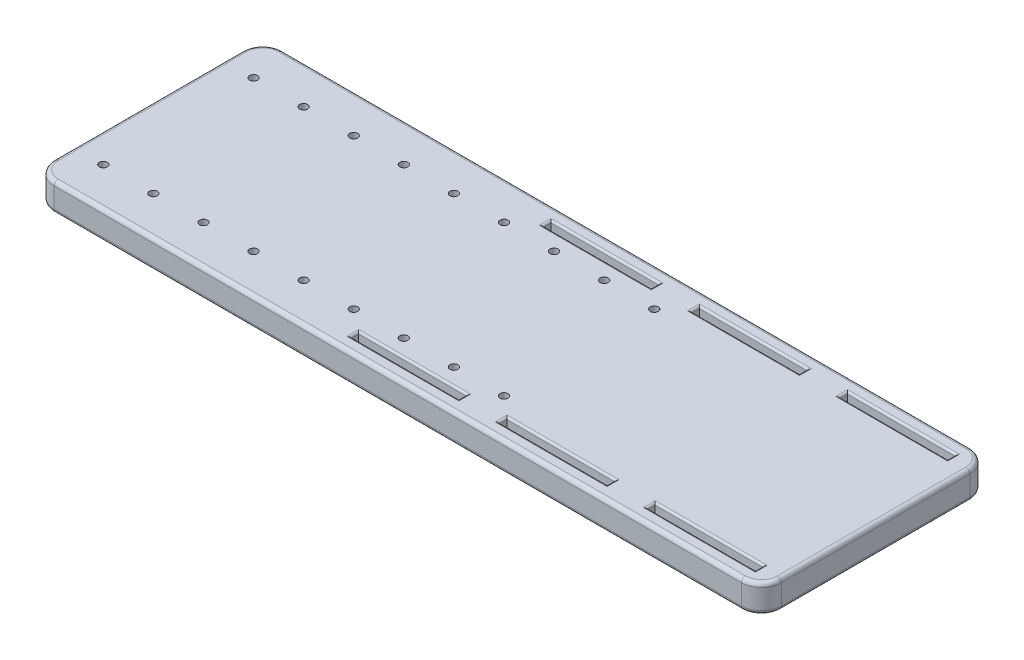
from build123d import *

# Parameters (mm, degrees)
SKETCH6_W              = 181.5
SKETCH6_H              = 7
BOSS_EXTRUDE2_DEPTH    = 28.5
SKETCH2_W              = 27
SKETCH2_H              = 2
CUT_EXTRUDE1_DEPTH     = 7
SKETCH3_R              = 1
CUT_EXTRUDE2_DEPTH     = 96.377211639
SKETCH4_R              = 2
CUT_EXTRUDE3_DEPTH     = 1.75
FILLET5_R              = 0.5
LPATTERN1_COUNT        = 9
LPATTERN1_PITCH        = 12.5
FILLET5_OF_LPATTERN1_R = 0.5
FILLET2_R              = 0.5
FILLET6_R              = 5
FILLET7_R              = 1
PART_NUMBER_CUT_DEPTH  = 0.6


with BuildPart() as part:
    # Sketch6 → Boss-Extrude2 (new, symmetric)
    with BuildSketch(Plane.XY):
        Rectangle(SKETCH6_W, SKETCH6_H)
    extrude(amount=BOSS_EXTRUDE2_DEPTH, both=True)

    # Sketch2 → Cut-Extrude1 (cut)
    with BuildSketch(Plane(origin=(0, 3.5, 24.5), x_dir=(1, 0, 0), z_dir=(0, -1, 0))):
        with Locations((-1.75, -0.5)):
            Rectangle(SKETCH2_W, SKETCH2_H)
        with Locations((35.25, -0.5)):
            Rectangle(SKETCH2_W, SKETCH2_H)
        with Locations((72.25, -0.5)):
            Rectangle(SKETCH2_W, SKETCH2_H)
        with Locations((-1.75, -48.5)):
            Rectangle(SKETCH2_W, SKETCH2_H)
        with Locations((35.25, -48.5)):
            Rectangle(SKETCH2_W, SKETCH2_H)
        with Locations((72.25, -48.5)):
            Rectangle(SKETCH2_W, SKETCH2_H)
    extrude(amount=CUT_EXTRUDE1_DEPTH, mode=Mode.SUBTRACT)

    # Sketch3 → Cut-Extrude2 (cut, through all)
    with BuildSketch(Plane(origin=(0, 3.5, 0), x_dir=(1, 0, 0), z_dir=(0, 1, 0))):
        with Locations(Location((16.75, 18.75, 0), (0, 0, 270))):
            Circle(SKETCH3_R)
        with Locations(Location((16.75, -18.75, 0), (0, 0, 270))):
            Circle(SKETCH3_R)
    cut_extrude2 = extrude(amount=-CUT_EXTRUDE2_DEPTH, mode=Mode.SUBTRACT)

    # Sketch4 → Cut-Extrude3 (cut)
    with BuildSketch(Plane.XZ.offset(3.5)):
        with Locations(Location((16.75, -18.75, 0), (0, 0, 270))):
            Circle(SKETCH4_R)
        with Locations(Location((16.75, 18.75, 0), (0, 0, 270))):
            Circle(SKETCH4_R)
    cut_extrude3 = extrude(amount=-CUT_EXTRUDE3_DEPTH, mode=Mode.SUBTRACT)

    # Fillet5
    fillet5_edges = [part.edges().sort_by_distance(p)[0] for p in [
        (16.75, -3.5, -16.75),
        (16.75, -3.5, 20.75),
    ]]
    fillet(fillet5_edges, radius=FILLET5_R)

    # LPattern1: Cut-Extrude2, Cut-Extrude3 ×9
    with Locations(*[(-i * LPATTERN1_PITCH, 0, 0) for i in range(1, LPATTERN1_COUNT)]):
        add(cut_extrude2, mode=Mode.SUBTRACT)
        add(cut_extrude3, mode=Mode.SUBTRACT)

    # Fillet5 of LPattern1
    fillet5_of_lpattern1_edges = [part.edges().sort_by_distance(p)[0] for p in [
        (4.25, -3.5, -16.75),
        (4.25, -3.5, 20.75),
        (-8.25, -3.5, -16.75),
        (-8.25, -3.5, 20.75),
        (-20.75, -3.5, -16.75),
        (-20.75, -3.5, 20.75),
        (-33.25, -3.5, -16.75),
        (-33.25, -3.5, 20.75),
        (-45.75, -3.5, -16.75),
        (-45.75, -3.5, 20.75),
        (-58.25, -3.5, -16.75),
        (-58.25, -3.5, 20.75),
        (-70.75, -3.5, -16.75),
        (-70.75, -3.5, 20.75),
        (-83.25, -3.5, -16.75),
        (-83.25, -3.5, 20.75),
    ]]
    fillet(fillet5_of_lpattern1_edges, radius=FILLET5_OF_LPATTERN1_R)

    # Fillet2
    fillet2_edges = [part.edges().sort_by_distance(p)[0] for p in [
        (35.25, -3.5, 23),
        (35.25, 3.5, 23),
        (21.75, -3.5, 24),
        (21.75, 3.5, 24),
        (35.25, -3.5, 25),
        (35.25, 3.5, 25),
        (48.75, -3.5, 24),
        (48.75, 3.5, 24),
        (72.25, -3.5, 23),
        (72.25, 3.5, 23),
        (58.75, -3.5, 24),
        (58.75, 3.5, 24),
        (72.25, -3.5, 25),
        (72.25, 3.5, 25),
        (85.75, -3.5, 24),
        (85.75, 3.5, 24),
        (-1.75, -3.5, -25),
        (-1.75, 3.5, -25),
        (-15.25, -3.5, -24),
        (-15.25, 3.5, -24),
        (-1.75, -3.5, -23),
        (-1.75, 3.5, -23),
        (11.75, -3.5, -24),
        (11.75, 3.5, -24),
        (35.25, -3.5, -25),
        (35.25, 3.5, -25),
        (21.75, -3.5, -24),
        (21.75, 3.5, -24),
        (35.25, -3.5, -23),
        (35.25, 3.5, -23),
        (48.75, -3.5, -24),
        (48.75, 3.5, -24),
        (72.25, -3.5, -25),
        (72.25, 3.5, -25),
        (58.75, -3.5, -24),
        (58.75, 3.5, -24),
        (72.25, -3.5, -23),
        (72.25, 3.5, -23),
        (85.75, -3.5, -24),
        (85.75, 3.5, -24),
        (-1.75, -3.5, 23),
        (-1.75, 3.5, 23),
        (-15.25, -3.5, 24),
        (-15.25, 3.5, 24),
        (-1.75, -3.5, 25),
        (-1.75, 3.5, 25),
        (11.75, -3.5, 24),
        (11.75, 3.5, 24),
    ]]
    fillet(fillet2_edges, radius=FILLET2_R)

    # Fillet6
    fillet6_edges = [part.edges().sort_by_distance(p)[0] for p in [
        (-90.75, 0, 28.5),
        (90.75, 0, 28.5),
        (-90.75, 0, -28.5),
        (90.75, 0, -28.5),
    ]]
    fillet(fillet6_edges, radius=FILLET6_R)

    # Fillet7
    fillet7_edges = [part.edges().sort_by_distance(p)[0] for p in [
        (90.75, 3.5, 0),
        (90.75, -3.5, 0),
        (0, 3.5, -28.5),
        (-90.75, 3.5, 0),
        (0, 3.5, 28.5),
        (-89.285533906, 3.5, 27.035533906),
        (-89.285533906, 3.5, -27.035533906),
        (89.285533906, 3.5, 27.035533906),
        (89.285533906, 3.5, -27.035533906),
        (0, -3.5, -28.5),
        (0, -3.5, 28.5),
        (-90.75, -3.5, 0),
        (-89.285533906, -3.5, 27.035533906),
        (-89.285533906, -3.5, -27.035533906),
        (89.285533906, -3.5, 27.035533906),
        (89.285533906, -3.5, -27.035533906),
    ]]
    fillet(fillet7_edges, radius=FILLET7_R)

    # Sketch5 → Part Number Cut (cut)
    # profile 1 of 11: a face of its own
    with BuildSketch(Plane.XZ.offset(3.5)):
        with BuildLine():
            add(Edge.make_bspline(
                [(68.683823529, -2.101332721), (68.69136643, -2.123079058), (68.705427787, -2.163618237), (68.721376497, -2.222142998), (68.734151208, -2.273003038), (68.74285982, -2.317352364), (68.746135809, -2.355760522), (68.741286217, -2.388886294), (68.73139101, -2.418154126), (68.711784278, -2.441627935), (68.685420038, -2.460758067), (68.650408702, -2.473812876), (68.608265165, -2.485541104), (68.557215571, -2.491750943), (68.497325829, -2.494223721), (68.428053165, -2.498560386), (68.347956204, -2.49869243), (68.291281238, -2.499544946), (68.261029412, -2.5)],
                knots=[0, 0, 0, 0, 1.351975101, 2.52033068, 3.562719996, 4.432170766, 5.176088948, 5.812532786, 6.389296298, 6.965620705, 7.577732788, 8.283941723, 9.146375963, 10.145613058, 11.295182858, 12.669444765, 14.222224263, 16, 16, 16, 16], degree=3))
            add(Edge.make_bspline(
                [(68.261029412, -2.5), (68.230009604, -2.500073845), (68.171413975, -2.500213335), (68.089056227, -2.499298417), (68.017466438, -2.496544417), (67.940713379, -2.494440591), (67.863820094, -2.487123199), (67.789882321, -2.475060461), (67.736821816, -2.454852485), (67.700683874, -2.425048549), (67.680054692, -2.385630328), (67.670106445, -2.357657417), (67.664751838, -2.342601103)],
                knots=[0, 0, 0, 0, 1.402041787, 2.648421349, 3.722147351, 4.640185661, 6.117966101, 7.211050041, 8.017924191, 8.656254393, 9.276733986, 10, 10, 10, 10], degree=3))
            Line((67.664751838, -2.342601103), (67.359145221, -1.397058824))
            Line((67.359145221, -1.397058824), (65.47265625, -1.397058824))
            Line((65.47265625, -1.397058824), (65.183134191, -2.316176471))
            add(Edge.make_bspline(
                [(65.183134191, -2.316176471), (65.177894348, -2.332810138), (65.167916158, -2.364485492), (65.14525799, -2.408236707), (65.108764141, -2.442738079), (65.057309709, -2.468641444), (64.986249778, -2.484187382), (64.893215152, -2.495490983), (64.77258971, -2.498059366), (64.682970097, -2.499303624), (64.6328125, -2.5)],
                knots=[0, 0, 0, 0, 0.662368552, 1.261342941, 1.847645799, 2.537239812, 3.42265718, 4.595262896, 6.094463672, 8, 8, 8, 8], degree=3))
            add(Edge.make_bspline(
                [(64.6328125, -2.5), (64.604854744, -2.499711764), (64.551993651, -2.499166783), (64.477293478, -2.496960389), (64.412180125, -2.493475541), (64.356055728, -2.489585615), (64.308987245, -2.481965959), (64.269405055, -2.470370084), (64.237404744, -2.455098436), (64.204468433, -2.428168626), (64.182625111, -2.375965517), (64.18516076, -2.299198557), (64.209415668, -2.204066715), (64.231801045, -2.133356847), (64.244485294, -2.093290441)],
                knots=[0, 0, 0, 0, 1.279822224, 2.419822313, 3.420424811, 4.264789446, 4.993926375, 5.598399463, 6.14718048, 6.607326483, 7.517039103, 8.604050794, 10.075749779, 12, 12, 12, 12], degree=3))
            Line((64.244485294, -2.093290441), (65.756433824, 2.301240809))
            add(Edge.make_bspline(
                [(65.756433824, 2.301240809), (65.764333736, 2.320992227), (65.778942677, 2.35751761), (65.80804439, 2.40738236), (65.851700562, 2.44632885), (65.915205541, 2.4703788), (65.99822914, 2.488575316), (66.083780997, 2.494135904), (66.16619758, 2.49658454), (66.240869798, 2.4992387), (66.325134823, 2.50022817), (66.384497403, 2.500078943), (66.415900735, 2.5)],
                knots=[0, 0, 0, 0, 0.856868194, 1.584566637, 2.305859304, 3.162727498, 4.285524966, 5.725550839, 6.605441018, 7.608682037, 8.734971556, 10, 10, 10, 10], degree=3))
            add(Edge.make_bspline(
                [(66.415900735, 2.5), (66.451899647, 2.500075665), (66.520453019, 2.500219755), (66.617354198, 2.49925983), (66.702752359, 2.496611509), (66.795875831, 2.494092969), (66.89133176, 2.488795935), (66.98398463, 2.470465323), (67.053751928, 2.445946576), (67.1023646, 2.405251486), (67.133973037, 2.35158511), (67.148118772, 2.311494316), (67.155790441, 2.289751838)],
                knots=[0, 0, 0, 0, 1.298203691, 2.47219252, 3.494555852, 4.378870695, 5.833194716, 6.932857721, 7.781737059, 8.467837287, 9.169060755, 10, 10, 10, 10], degree=3))
            Line((67.155790441, 2.289751838), (68.683823529, -2.101332721))
        make_face()
        Polygon((66.404411765, 1.565946691), (66.400965074, 1.565946691), (65.7265625, -0.588235294), (67.098345588, -0.588235294), align=None, mode=Mode.SUBTRACT)
    # profile 2 of 11: a face of its own
    with BuildSketch(Plane.XZ.offset(3.5)):
        with BuildLine():
            add(Edge.make_bspline(
                [(63.794117647, -0.548023897), (63.793876151, -0.583279417), (63.793434362, -0.647775427), (63.785586345, -0.736152727), (63.77298417, -0.807833671), (63.753605486, -0.863383654), (63.729123687, -0.905722303), (63.696624309, -0.93422422), (63.658088486, -0.953167277), (63.629673259, -0.954953195), (63.614889706, -0.955882353)],
                knots=[0, 0, 0, 0, 1.70714895, 3.123037127, 4.294581022, 5.221789102, 5.96315644, 6.63332839, 7.288963511, 8, 8, 8, 8], degree=3))
            Line((63.614889706, -0.955882353), (61.992647059, -0.955882353))
            add(Edge.make_bspline(
                [(61.992647059, -0.955882353), (61.977112105, -0.954981845), (61.947607648, -0.953271572), (61.907126152, -0.934365088), (61.874002506, -0.904466027), (61.847707291, -0.861622762), (61.830879996, -0.804699716), (61.816952144, -0.733598672), (61.809692166, -0.646202529), (61.809128549, -0.582499038), (61.808823529, -0.548023897)],
                knots=[0, 0, 0, 0, 0.742130552, 1.409476935, 2.100526384, 2.861596483, 3.793076646, 4.9376098, 6.342691551, 8, 8, 8, 8], degree=3))
            add(Edge.make_bspline(
                [(61.808823529, -0.548023897), (61.809116018, -0.513926288), (61.809655996, -0.450977142), (61.817040126, -0.364783236), (61.830504269, -0.294999094), (61.848327074, -0.239688084), (61.873585388, -0.197250674), (61.907551135, -0.168677344), (61.947553891, -0.149610507), (61.977093563, -0.147938948), (61.992647059, -0.147058824)],
                knots=[0, 0, 0, 0, 1.66002107, 3.064640367, 4.20563049, 5.113809181, 5.884686017, 6.572361307, 7.248306755, 8, 8, 8, 8], degree=3))
            Line((61.992647059, -0.147058824), (63.614889706, -0.147058824))
            add(Edge.make_bspline(
                [(63.614889706, -0.147058824), (63.629620617, -0.147655959), (63.657311153, -0.148778429), (63.695853567, -0.165256687), (63.72860488, -0.193138217), (63.753457603, -0.236103375), (63.774607613, -0.292104205), (63.784914563, -0.364311016), (63.793587357, -0.450909411), (63.793931328, -0.513902491), (63.794117647, -0.548023897)],
                knots=[0, 0, 0, 0, 0.715517841, 1.344999761, 2.009177568, 2.783309658, 3.743277578, 4.922418291, 6.332969005, 8, 8, 8, 8], degree=3))
        make_face()
    # profile 3 of 11: a face of its own
    with BuildSketch(Plane.XZ.offset(3.5)):
        with BuildLine():
            add(Edge.make_bspline(
                [(61.220588235, -0.867417279), (61.218801189, -0.932992877), (61.215306041, -1.061247166), (61.188602682, -1.24849038), (61.143981986, -1.424957292), (61.081529263, -1.590104112), (61.003759984, -1.743427898), (60.909026753, -1.883744042), (60.801538012, -2.013137269), (60.67729095, -2.128325096), (60.539951724, -2.230752961), (60.389524498, -2.32097884), (60.225721556, -2.397656409), (60.049694845, -2.461954429), (59.862499777, -2.512426015), (59.664505029, -2.547521351), (59.456789614, -2.57007356), (59.314628279, -2.572362859), (59.2421875, -2.573529412)],
                knots=[0, 0, 0, 0, 1.06697082, 2.086806491, 3.070914618, 4.02363306, 4.954656601, 5.862205625, 6.773556322, 7.686376441, 8.612568136, 9.557486927, 10.536112515, 11.55159642, 12.603902796, 13.687080049, 14.821411453, 16, 16, 16, 16], degree=3))
            add(Edge.make_bspline(
                [(59.2421875, -2.573529412), (59.165936036, -2.572185334), (59.017386953, -2.569566872), (58.802082069, -2.549971029), (58.603655897, -2.518731663), (58.425931433, -2.482025742), (58.274806675, -2.439769472), (58.167566656, -2.40381676), (58.097496249, -2.376481683), (58.058628947, -2.356806236), (58.026984458, -2.341115906), (57.999131858, -2.320576205), (57.974321526, -2.293408556), (57.952580846, -2.257873481), (57.939573207, -2.216685359), (57.927253271, -2.169692316), (57.920218303, -2.112580293), (57.91399838, -2.043641842), (57.912816195, -1.961546049), (57.912131367, -1.90218609), (57.911764706, -1.870404412)],
                knots=[0, 0, 0, 0, 2.352153803, 4.582342044, 6.662667079, 8.546514862, 10.177514967, 11.500105838, 12.035421318, 12.4951253, 12.844003289, 13.122835489, 13.557570542, 13.970909211, 14.396887048, 14.884011341, 15.46879923, 16.168353294, 17.019325374, 18, 18, 18, 18], degree=3))
            add(Edge.make_bspline(
                [(57.911764706, -1.870404412), (57.912404607, -1.835939038), (57.913571287, -1.773101102), (57.916905251, -1.686635152), (57.926787761, -1.616502142), (57.941465142, -1.560719105), (57.960063828, -1.519000522), (57.982687649, -1.489891641), (58.009850503, -1.472930241), (58.029508738, -1.471366487), (58.039292279, -1.470588235)],
                knots=[0, 0, 0, 0, 1.822902001, 3.323550125, 4.572139576, 5.559599618, 6.365772599, 6.969872283, 7.487324433, 8, 8, 8, 8], degree=3))
            add(Edge.make_bspline(
                [(58.039292279, -1.470588235), (58.056035105, -1.473644989), (58.098218634, -1.481346477), (58.165167469, -1.521979522), (58.256409683, -1.569254152), (58.373928151, -1.622666109), (58.518453654, -1.674595602), (58.656838693, -1.71468642), (58.782898276, -1.739643856), (58.890197054, -1.755079979), (59.006953102, -1.762177425), (59.087846742, -1.763845168), (59.129595588, -1.764705882)],
                knots=[0, 0, 0, 0, 0.444011661, 1.118686809, 2.027427457, 3.152785246, 4.501835654, 6.058794642, 6.93060907, 7.875047181, 8.903321363, 10, 10, 10, 10], degree=3))
            add(Edge.make_bspline(
                [(59.129595588, -1.764705882), (59.200951667, -1.762698558), (59.338128697, -1.758839618), (59.504511901, -1.72935619), (59.625089712, -1.691284104), (59.708158051, -1.659448041), (59.782556651, -1.616626152), (59.850667948, -1.568604178), (59.912094128, -1.513433081), (59.964792228, -1.450585293), (60.011678307, -1.382594995), (60.049194126, -1.306878776), (60.081268875, -1.224590165), (60.102159297, -1.134056895), (60.115057971, -1.035912159), (60.116760376, -0.968181403), (60.117647059, -0.932904412)],
                knots=[0, 0, 0, 0, 2.032782473, 3.907880992, 4.788067796, 5.635158135, 6.436515337, 7.226873511, 8.007222909, 8.781366493, 9.559270127, 10.354810048, 11.183780612, 12.070505633, 12.995039183, 14, 14, 14, 14], degree=3))
            add(Edge.make_bspline(
                [(60.117647059, -0.932904412), (60.116992305, -0.902243505), (60.11571975, -0.842652113), (60.105675894, -0.755951574), (60.086849038, -0.674912579), (60.061865522, -0.598392943), (60.028668292, -0.527421278), (59.98774092, -0.461586335), (59.938530891, -0.40177805), (59.87972768, -0.348815152), (59.814109537, -0.299426357), (59.737826723, -0.258786554), (59.652992085, -0.224327496), (59.559321915, -0.195251012), (59.455695809, -0.174330076), (59.342212277, -0.157833795), (59.218192771, -0.149219325), (59.131904465, -0.14779738), (59.087086397, -0.147058824)],
                knots=[0, 0, 0, 0, 0.990747943, 1.925580712, 2.814217929, 3.675193293, 4.522270198, 5.339531786, 6.174590224, 7.015406179, 7.891633713, 8.822032467, 9.798768499, 10.847855848, 11.98621392, 13.211340836, 14.551572957, 16, 16, 16, 16], degree=3))
            add(Edge.make_bspline(
                [(59.087086397, -0.147058824), (59.016176731, -0.147881712), (58.880640858, -0.14945457), (58.687160488, -0.168880132), (58.509238086, -0.189874173), (58.394744551, -0.191988254), (58.339154412, -0.193014706)],
                knots=[0, 0, 0, 0, 1.134417109, 2.168311031, 3.110658559, 4, 4, 4, 4], degree=3))
            add(Edge.make_bspline(
                [(58.339154412, -0.193014706), (58.321852941, -0.192480943), (58.289570414, -0.191485005), (58.244738824, -0.18094774), (58.207191568, -0.16435497), (58.176906038, -0.138373253), (58.156518613, -0.101748281), (58.141298545, -0.055474712), (58.134743709, 0.002130279), (58.13319045, 0.04403905), (58.132352941, 0.066636029)],
                knots=[0, 0, 0, 0, 1.070487309, 1.997404571, 2.836260287, 3.593209122, 4.423627128, 5.399401485, 6.59777159, 8, 8, 8, 8], degree=3))
            Line((58.132352941, 0.066636029), (58.132352941, 2.213924632))
            add(Edge.make_bspline(
                [(58.132352941, 2.213924632), (58.13276135, 2.237733772), (58.133518164, 2.281854001), (58.145247853, 2.342631957), (58.162964747, 2.393474226), (58.189816424, 2.434431372), (58.227015108, 2.464498713), (58.271654417, 2.486361944), (58.326031851, 2.497241004), (58.364390679, 2.499032383), (58.385110294, 2.5)],
                knots=[0, 0, 0, 0, 1.291048597, 2.392415675, 3.346680984, 4.200455207, 5.012683301, 5.914987328, 6.873775246, 8, 8, 8, 8], degree=3))
            Line((58.385110294, 2.5), (60.766773897, 2.5))
            add(Edge.make_bspline(
                [(60.766773897, 2.5), (60.778524452, 2.498945273), (60.802734608, 2.496772177), (60.835631586, 2.476089906), (60.866009044, 2.445104916), (60.887595026, 2.39804971), (60.906463904, 2.338032288), (60.917482352, 2.261713319), (60.925908814, 2.168931927), (60.926272525, 2.101363344), (60.926470588, 2.064568015)],
                knots=[0, 0, 0, 0, 0.553923566, 1.141271771, 1.798199546, 2.596456404, 3.569952235, 4.788584081, 6.251182718, 8, 8, 8, 8], degree=3))
            add(Edge.make_bspline(
                [(60.926470588, 2.064568015), (60.926208338, 2.028166695), (60.925718951, 1.960237997), (60.91776534, 1.866581731), (60.905791547, 1.788779694), (60.889112928, 1.726789198), (60.867477783, 1.678517653), (60.839995367, 1.64417319), (60.80687678, 1.621750184), (60.782396797, 1.619010008), (60.770220588, 1.617647059)],
                knots=[0, 0, 0, 0, 1.705538939, 3.182715304, 4.401402576, 5.39006858, 6.184910218, 6.860567929, 7.433252789, 8, 8, 8, 8], degree=3))
            Line((60.770220588, 1.617647059), (59.014705882, 1.617647059))
            Line((59.014705882, 1.617647059), (59.014705882, 0.565257353))
            add(Edge.make_bspline(
                [(59.014705882, 0.565257353), (59.059096563, 0.569868593), (59.146977848, 0.578997575), (59.280412498, 0.585712244), (59.416432581, 0.587177421), (59.508731851, 0.587877839), (59.555836397, 0.588235294)],
                knots=[0, 0, 0, 0, 0.98809062, 1.956146446, 2.956927895, 4, 4, 4, 4], degree=3))
            add(Edge.make_bspline(
                [(59.555836397, 0.588235294), (59.620591191, 0.587148662), (59.746894189, 0.585029207), (59.930566779, 0.568150051), (60.102937936, 0.538008427), (60.264133742, 0.497145913), (60.413629964, 0.444246274), (60.552010993, 0.381203526), (60.677246076, 0.305498391), (60.789618787, 0.218199511), (60.89083454, 0.121910988), (60.977257623, 0.012140376), (61.052458445, -0.10727309), (61.113427647, -0.238709754), (61.16177717, -0.380379951), (61.195966081, -0.533287596), (61.216899835, -0.696797954), (61.219336732, -0.809524782), (61.220588235, -0.867417279)],
                knots=[0, 0, 0, 0, 1.233638519, 2.406188574, 3.509786213, 4.564519873, 5.570688591, 6.527218667, 7.456964246, 8.351604632, 9.23399176, 10.111417538, 11.006266177, 11.916948856, 12.865290053, 13.852981671, 14.897367593, 16, 16, 16, 16], degree=3))
        make_face()
    # profile 4 of 11: a face of its own
    with BuildSketch(Plane.XZ.offset(3.5)):
        with BuildLine():
            add(Edge.make_bspline(
                [(57.323529412, -0.548023897), (57.323287916, -0.583279417), (57.322846126, -0.647775427), (57.31499811, -0.736152727), (57.302395935, -0.807833671), (57.283017251, -0.863383654), (57.258535452, -0.905722303), (57.226036074, -0.93422422), (57.187500251, -0.953167277), (57.159085024, -0.954953195), (57.144301471, -0.955882353)],
                knots=[0, 0, 0, 0, 1.70714895, 3.123037127, 4.294581022, 5.221789102, 5.96315644, 6.63332839, 7.288963511, 8, 8, 8, 8], degree=3))
            Line((57.144301471, -0.955882353), (55.522058824, -0.955882353))
            add(Edge.make_bspline(
                [(55.522058824, -0.955882353), (55.50652387, -0.954981845), (55.477019413, -0.953271572), (55.436537917, -0.934365088), (55.403414271, -0.904466027), (55.377119056, -0.861622762), (55.360291761, -0.804699716), (55.346363909, -0.733598672), (55.339103931, -0.646202529), (55.338540313, -0.582499038), (55.338235294, -0.548023897)],
                knots=[0, 0, 0, 0, 0.742130552, 1.409476935, 2.100526384, 2.861596483, 3.793076646, 4.9376098, 6.342691551, 8, 8, 8, 8], degree=3))
            add(Edge.make_bspline(
                [(55.338235294, -0.548023897), (55.338527783, -0.513926288), (55.33906776, -0.450977142), (55.346451891, -0.364783236), (55.359916034, -0.294999094), (55.377738838, -0.239688084), (55.402997152, -0.197250674), (55.4369629, -0.168677344), (55.476965656, -0.149610507), (55.506505328, -0.147938948), (55.522058824, -0.147058824)],
                knots=[0, 0, 0, 0, 1.66002107, 3.064640367, 4.20563049, 5.113809181, 5.884686017, 6.572361307, 7.248306755, 8, 8, 8, 8], degree=3))
            Line((55.522058824, -0.147058824), (57.144301471, -0.147058824))
            add(Edge.make_bspline(
                [(57.144301471, -0.147058824), (57.159032382, -0.147655959), (57.186722917, -0.148778429), (57.225265331, -0.165256687), (57.258016644, -0.193138217), (57.282869368, -0.236103375), (57.304019378, -0.292104205), (57.314326328, -0.364311016), (57.322999122, -0.450909411), (57.323343093, -0.513902491), (57.323529412, -0.548023897)],
                knots=[0, 0, 0, 0, 0.715517841, 1.344999761, 2.009177568, 2.783309658, 3.743277578, 4.922418291, 6.332969005, 8, 8, 8, 8], degree=3))
        make_face()
    # profile 5 of 11: a face of its own
    with BuildSketch(Plane.XZ.offset(3.5)):
        with BuildLine():
            add(Edge.make_bspline(
                [(54.897058824, 0.01953125), (54.896093079, -0.077388473), (54.894209359, -0.266433948), (54.875577903, -0.5429235), (54.84462333, -0.804782033), (54.80296301, -1.052126899), (54.74763851, -1.28386908), (54.675071223, -1.498350917), (54.58802765, -1.695603836), (54.486073097, -1.875223236), (54.366544237, -2.035068584), (54.231919402, -2.177013735), (54.07840245, -2.296943796), (53.909006588, -2.398273019), (53.721320892, -2.477993935), (53.513843513, -2.534191132), (53.286980429, -2.567146427), (53.129018419, -2.571353756), (53.047334559, -2.573529412)],
                knots=[0, 0, 0, 0, 1.280142505, 2.496964928, 3.658445283, 4.762089533, 5.808699902, 6.802158264, 7.748814871, 8.653008089, 9.524146816, 10.379274413, 11.229404425, 12.089188086, 12.979964829, 13.913938538, 14.921275101, 16, 16, 16, 16], degree=3))
            add(Edge.make_bspline(
                [(53.047334559, -2.573529412), (52.964510878, -2.571304742), (52.805850593, -2.567043076), (52.578582214, -2.535402314), (52.373919165, -2.480653569), (52.190667835, -2.404174278), (52.027362308, -2.307003077), (51.884590822, -2.18772438), (51.755669238, -2.052840621), (51.648153229, -1.895420344), (51.555839994, -1.720583417), (51.479729885, -1.527568889), (51.415600323, -1.317305106), (51.37028206, -1.088447709), (51.336686177, -0.843150919), (51.311402196, -0.582543062), (51.296338198, -0.306169554), (51.29487136, -0.116823761), (51.294117647, -0.01953125)],
                knots=[0, 0, 0, 0, 1.116564975, 2.138935591, 3.085931557, 3.965362537, 4.808430945, 5.637530691, 6.466775146, 7.316224023, 8.198621357, 9.127780993, 10.109559384, 11.158728965, 12.269463774, 13.447127443, 14.688244517, 16, 16, 16, 16], degree=3))
            add(Edge.make_bspline(
                [(51.294117647, -0.01953125), (51.294890971, 0.077021564), (51.296399433, 0.265359586), (51.317723707, 0.540842646), (51.345747121, 0.802693725), (51.389571828, 1.050236447), (51.446130081, 1.282514851), (51.517839601, 1.497796631), (51.605716712, 1.694748512), (51.707788051, 1.874140218), (51.826485827, 2.035400586), (51.962763851, 2.176597782), (52.116147648, 2.297012998), (52.285637659, 2.398248933), (52.473293629, 2.478019608), (52.680059497, 2.533909094), (52.90570164, 2.567261009), (53.062534694, 2.571389218), (53.143841912, 2.573529412)],
                knots=[0, 0, 0, 0, 1.275935792, 2.488868156, 3.650539398, 4.755790181, 5.809222936, 6.808140458, 7.750805295, 8.655602092, 9.531384403, 10.390594486, 11.241291987, 12.101649582, 12.993020947, 13.927618113, 14.925611662, 16, 16, 16, 16], degree=3))
            add(Edge.make_bspline(
                [(53.143841912, 2.573529412), (53.226701306, 2.571960846), (53.385879746, 2.568947527), (53.613034496, 2.534642711), (53.819175265, 2.482308718), (54.002577198, 2.403931678), (54.166681852, 2.30685672), (54.311930127, 2.189693097), (54.438393035, 2.052330669), (54.546666756, 1.89558099), (54.638560266, 1.72048756), (54.715549428, 1.528000093), (54.775957413, 1.316843398), (54.822191907, 1.088511918), (54.855952155, 0.843202175), (54.87935563, 0.582471385), (54.894952882, 0.306179256), (54.896344012, 0.116827054), (54.897058824, 0.01953125)],
                knots=[0, 0, 0, 0, 1.1154279, 2.142811628, 3.087698179, 3.973172265, 4.819981724, 5.64914424, 6.477969577, 7.326725871, 8.20840376, 9.136805822, 10.114848545, 11.163162705, 12.272991897, 13.449208879, 14.689314032, 16, 16, 16, 16], degree=3))
        make_face()
        with BuildLine():
            add(Edge.make_bspline(
                [(53.867647059, -0.032169118), (53.867400194, 0.024892759), (53.866922983, 0.135198054), (53.86400812, 0.295723478), (53.856353936, 0.445417911), (53.84917244, 0.585709702), (53.837395141, 0.716305921), (53.823672462, 0.838121225), (53.808226463, 0.950963434), (53.782261213, 1.084517872), (53.748563587, 1.233469254), (53.691865831, 1.387974606), (53.626815969, 1.51609447), (53.543852164, 1.613850722), (53.450712544, 1.688251753), (53.343234678, 1.733949348), (53.226045968, 1.761169863), (53.144004888, 1.76349599), (53.101332721, 1.764705882)],
                knots=[0, 0, 0, 0, 1.252656067, 2.421487074, 3.523945301, 4.542880805, 5.504947389, 6.401770782, 7.23401126, 8.00401156, 9.388497809, 10.580084833, 11.61067594, 12.523473101, 13.374357542, 14.202341007, 15.064980546, 16, 16, 16, 16], degree=3))
            add(Edge.make_bspline(
                [(53.101332721, 1.764705882), (53.064441985, 1.76355323), (52.993477451, 1.761335941), (52.892272485, 1.739615937), (52.799746129, 1.707320587), (52.718501816, 1.657496921), (52.645338235, 1.595589463), (52.582713107, 1.518256539), (52.525725629, 1.429170951), (52.477918717, 1.326182059), (52.438225588, 1.209984164), (52.403694799, 1.081076783), (52.376516636, 0.938206502), (52.356444223, 0.782006409), (52.34178231, 0.612558266), (52.332010965, 0.429773286), (52.324654558, 0.233667731), (52.323912104, 0.098429773), (52.323529412, 0.028722426)],
                knots=[0, 0, 0, 0, 0.830406459, 1.597403976, 2.323929485, 3.028688112, 3.73286484, 4.474568648, 5.262512747, 6.112128818, 7.026802286, 8.027809387, 9.118195914, 10.302553145, 11.576589742, 12.951469302, 14.428658737, 16, 16, 16, 16], degree=3))
            add(Edge.make_bspline(
                [(52.323529412, 0.028722426), (52.323854435, -0.055535356), (52.324475103, -0.216434858), (52.332256873, -0.446339345), (52.34627677, -0.653566982), (52.363463024, -0.839297674), (52.38893594, -1.00453124), (52.419515409, -1.151209398), (52.455977569, -1.280360469), (52.497719805, -1.392901968), (52.547457208, -1.488710923), (52.603895335, -1.568765062), (52.666353749, -1.634798394), (52.736640235, -1.685304744), (52.814603658, -1.721213875), (52.898742227, -1.74564108), (52.989567609, -1.763042342), (53.052606949, -1.764138369), (53.085248162, -1.764705882)],
                knots=[0, 0, 0, 0, 1.85321902, 3.538925519, 5.058498589, 6.421342315, 7.640056482, 8.733733654, 9.714903156, 10.58939389, 11.369318339, 12.082176755, 12.737469836, 13.359260972, 13.973474606, 14.615698241, 15.283220796, 16, 16, 16, 16], degree=3))
            add(Edge.make_bspline(
                [(53.085248162, -1.764705882), (53.133374709, -1.762852145), (53.225362163, -1.759308974), (53.35516972, -1.722631302), (53.468730253, -1.661975475), (53.565219485, -1.574319353), (53.647197618, -1.463980325), (53.712175566, -1.327993604), (53.765096586, -1.170367391), (53.807258619, -0.989533521), (53.837688422, -0.78513526), (53.856013356, -0.555990651), (53.865785647, -0.302250051), (53.867008257, -0.124855901), (53.867647059, -0.032169118)],
                knots=[0, 0, 0, 0, 0.812198358, 1.552408438, 2.25954763, 2.970620909, 3.738781613, 4.570097942, 5.508197261, 6.546623335, 7.706294858, 8.999891258, 10.432471252, 12, 12, 12, 12], degree=3))
        make_face(mode=Mode.SUBTRACT)
    # profile 6 of 11: a face of its own
    with BuildSketch(Plane.XZ.offset(3.5)):
        with BuildLine():
            add(Edge.make_bspline(
                [(50.926470588, -1.069623162), (50.92620645, -1.100282386), (50.925710111, -1.15789381), (50.917540724, -1.238548472), (50.905337054, -1.307816133), (50.888926886, -1.365740333), (50.867154993, -1.411204699), (50.842384008, -1.445687687), (50.810663637, -1.465765897), (50.788056074, -1.469015447), (50.777113971, -1.470588235)],
                knots=[0, 0, 0, 0, 1.593603655, 2.994523807, 4.209267046, 5.248799156, 6.112701127, 6.821812225, 7.429754874, 8, 8, 8, 8], degree=3))
            Line((50.777113971, -1.470588235), (50.338235294, -1.470588235))
            Line((50.338235294, -1.470588235), (50.338235294, -2.349494485))
            add(Edge.make_bspline(
                [(50.338235294, -2.349494485), (50.33716401, -2.361570128), (50.335038969, -2.385523845), (50.316200313, -2.419122097), (50.281359463, -2.445265529), (50.232292459, -2.466358981), (50.166175761, -2.481527386), (50.082356554, -2.492530331), (49.976431532, -2.499099716), (49.898217615, -2.499677445), (49.854549632, -2.5)],
                knots=[0, 0, 0, 0, 0.525703783, 1.042806514, 1.625893093, 2.39765282, 3.364048858, 4.581030562, 6.091138931, 8, 8, 8, 8], degree=3))
            add(Edge.make_bspline(
                [(49.854549632, -2.5), (49.812801175, -2.49963345), (49.73651081, -2.498963623), (49.632454527, -2.492588507), (49.548756648, -2.481368475), (49.482997941, -2.466932781), (49.43561942, -2.444913605), (49.401562931, -2.419369492), (49.386077658, -2.384887264), (49.383613705, -2.361474443), (49.382352941, -2.349494485)],
                knots=[0, 0, 0, 0, 1.858233089, 3.39570102, 4.63473153, 5.61863636, 6.373449397, 6.953985978, 7.464771718, 8, 8, 8, 8], degree=3))
            Line((49.382352941, -2.349494485), (49.382352941, -1.470588235))
            Line((49.382352941, -1.470588235), (47.407398897, -1.470588235))
            add(Edge.make_bspline(
                [(47.407398897, -1.470588235), (47.389766974, -1.469876784), (47.356079575, -1.468517491), (47.307220967, -1.459552945), (47.263983702, -1.435060256), (47.229061278, -1.392653049), (47.204936805, -1.330662756), (47.187021469, -1.248241529), (47.177985497, -1.140272522), (47.177014907, -1.059675727), (47.176470588, -1.014476103)],
                knots=[0, 0, 0, 0, 0.721830018, 1.379122135, 2.010344175, 2.710096748, 3.579823955, 4.704200885, 6.15167733, 8, 8, 8, 8], degree=3))
            add(Edge.make_bspline(
                [(47.176470588, -1.014476103), (47.176569098, -0.97617591), (47.176752414, -0.90490359), (47.181161186, -0.804835622), (47.189414747, -0.717074564), (47.200066906, -0.63810387), (47.217845213, -0.565520849), (47.241131157, -0.496248046), (47.272091192, -0.427738366), (47.295379289, -0.382100738), (47.307444853, -0.358455882)],
                knots=[0, 0, 0, 0, 1.355920511, 2.523214427, 3.544523483, 4.476419512, 5.341300522, 6.18596521, 7.060148557, 8, 8, 8, 8], degree=3))
            Line((47.307444853, -0.358455882), (48.906709559, 2.365579044))
            add(Edge.make_bspline(
                [(48.906709559, 2.365579044), (48.914946126, 2.376872398), (48.932829216, 2.401392327), (48.976571044, 2.429109831), (49.03561092, 2.451185385), (49.113038862, 2.470656691), (49.211116692, 2.484934533), (49.332070836, 2.493000483), (49.478038042, 2.498788736), (49.584167894, 2.499572749), (49.642003676, 2.5)],
                knots=[0, 0, 0, 0, 0.433899394, 0.942074677, 1.586920186, 2.403031765, 3.43269784, 4.681722832, 6.191694851, 8, 8, 8, 8], degree=3))
            add(Edge.make_bspline(
                [(49.642003676, 2.5), (49.701000043, 2.499795163), (49.809483975, 2.499418503), (49.958516077, 2.491066705), (50.080498039, 2.480065846), (50.176081096, 2.461723106), (50.248746431, 2.440610443), (50.298328719, 2.411246643), (50.332763836, 2.376663886), (50.336468138, 2.348157802), (50.338235294, 2.334558824)],
                knots=[0, 0, 0, 0, 1.870363282, 3.439268813, 4.733465961, 5.748069416, 6.52766601, 7.110840176, 7.575821608, 8, 8, 8, 8], degree=3))
            Line((50.338235294, 2.334558824), (50.338235294, -0.661764706))
            Line((50.338235294, -0.661764706), (50.777113971, -0.661764706))
            add(Edge.make_bspline(
                [(50.777113971, -0.661764706), (50.787313221, -0.662921021), (50.808414957, -0.66531338), (50.837593951, -0.68499002), (50.862379051, -0.716208555), (50.885710459, -0.758774304), (50.905050296, -0.814893967), (50.918016035, -0.886054355), (50.925705447, -0.972561125), (50.926201754, -1.035520184), (50.926470588, -1.069623162)],
                knots=[0, 0, 0, 0, 0.51983486, 1.075512151, 1.744218405, 2.552791553, 3.552578929, 4.773200779, 6.252142485, 8, 8, 8, 8], degree=3))
        make_face()
        Polygon((49.382352941, 1.617647059), (49.374310662, 1.617647059), (47.985294118, -0.661764706), (49.382352941, -0.661764706), align=None, mode=Mode.SUBTRACT)
    # profile 7 of 11: a face of its own
    with BuildSketch(Plane.XZ.offset(3.5)):
        with BuildLine():
            add(Edge.make_bspline(
                [(46.661764706, -0.999540441), (46.660921927, -1.042854099), (46.65926921, -1.127793563), (46.645122675, -1.252270895), (46.622520443, -1.370712732), (46.590330662, -1.482555572), (46.549341489, -1.587225137), (46.503893723, -1.686995967), (46.449740864, -1.779896603), (46.388484838, -1.866692016), (46.320346319, -1.94691243), (46.247066261, -2.022402042), (46.165583068, -2.089801899), (46.05033587, -2.175044055), (45.890497504, -2.265834474), (45.683497319, -2.354444657), (45.459634799, -2.420559596), (45.263064212, -2.459311765), (45.097248293, -2.480428042), (44.964632699, -2.491796577), (44.82513608, -2.498732037), (44.729710968, -2.499571876), (44.681066176, -2.5)],
                knots=[0, 0, 0, 0, 0.924869681, 1.813698953, 2.671929785, 3.497741784, 4.295238828, 5.071047982, 5.837050105, 6.588235223, 7.337056364, 8.083192266, 8.832013407, 9.592756872, 11.143016317, 12.74439455, 14.392794953, 16.118857481, 17.017754023, 17.961953565, 18.961066516, 20, 20, 20, 20], degree=3))
            Line((44.681066176, -2.5), (43.358685662, -2.5))
            add(Edge.make_bspline(
                [(43.358685662, -2.5), (43.338309526, -2.499184204), (43.29896553, -2.497608996), (43.241894485, -2.483386983), (43.190545788, -2.458865376), (43.143001473, -2.42685338), (43.103650867, -2.3820537), (43.078104527, -2.323927681), (43.061607471, -2.255424387), (43.059796099, -2.20599667), (43.058823529, -2.179457721)],
                knots=[0, 0, 0, 0, 0.978793994, 1.889939582, 2.804428835, 3.703585142, 4.63041425, 5.627232269, 6.726002966, 8, 8, 8, 8], degree=3))
            Line((43.058823529, -2.179457721), (43.058823529, 2.179457721))
            add(Edge.make_bspline(
                [(43.058823529, 2.179457721), (43.059816246, 2.205989183), (43.061665141, 2.255402955), (43.077837497, 2.323658372), (43.103945279, 2.381198151), (43.143332397, 2.425589797), (43.190159091, 2.459036238), (43.241943692, 2.483316083), (43.298952178, 2.497628235), (43.33830497, 2.499190769), (43.358685662, 2.5)],
                knots=[0, 0, 0, 0, 1.274945825, 2.374534816, 3.355443708, 4.282963059, 5.193482606, 6.108652912, 7.020477063, 8, 8, 8, 8], degree=3))
            Line((43.358685662, 2.5), (44.609834559, 2.5))
            add(Edge.make_bspline(
                [(44.609834559, 2.5), (44.683008471, 2.49928197), (44.824160508, 2.497896895), (45.026681361, 2.482842233), (45.211987763, 2.458934065), (45.380853344, 2.426373772), (45.534662161, 2.382070493), (45.676170799, 2.330089103), (45.803954934, 2.265193074), (45.919642196, 2.191583223), (46.023468471, 2.108468397), (46.113194227, 2.013937549), (46.190058167, 1.908752225), (46.254756923, 1.793684339), (46.305060479, 1.667639792), (46.342403908, 1.531361957), (46.364116821, 1.384356736), (46.366450597, 1.282624195), (46.367647059, 1.23046875)],
                knots=[0, 0, 0, 0, 1.422535359, 2.744062161, 3.945671556, 5.054054835, 6.084028266, 7.054893494, 7.980650676, 8.864712083, 9.717130842, 10.559835018, 11.390878574, 12.24430494, 13.119573574, 14.022776017, 14.986332244, 16, 16, 16, 16], degree=3))
            add(Edge.make_bspline(
                [(46.367647059, 1.23046875), (46.365525835, 1.171699516), (46.361356094, 1.056175462), (46.326107405, 0.889314403), (46.269847786, 0.734536575), (46.191279141, 0.594272296), (46.090795173, 0.469538009), (45.970334099, 0.361548911), (45.831672247, 0.268628572), (45.727816658, 0.225397635), (45.674862132, 0.203354779)],
                knots=[0, 0, 0, 0, 1.064274459, 2.092069132, 3.075913786, 4.039345789, 4.992217936, 5.965278652, 6.962523792, 8, 8, 8, 8], degree=3))
            add(Edge.make_bspline(
                [(45.674862132, 0.203354779), (45.709443655, 0.19618302), (45.778084026, 0.181947897), (45.878211445, 0.1521895), (45.973672154, 0.113960009), (46.064822446, 0.069169248), (46.15113248, 0.017107139), (46.23327341, -0.040829908), (46.307555085, -0.108293684), (46.37706046, -0.18091613), (46.440695014, -0.259900213), (46.495527629, -0.347275948), (46.5455536, -0.44005373), (46.586448584, -0.540326568), (46.620173736, -0.64623764), (46.64404175, -0.758577353), (46.659571916, -0.876938618), (46.661024051, -0.958129458), (46.661764706, -0.999540441)],
                knots=[0, 0, 0, 0, 0.996598969, 1.978135123, 2.943647814, 3.896000454, 4.841457252, 5.786419563, 6.728099347, 7.668537465, 8.622361299, 9.584904388, 10.576213204, 11.593984834, 12.63670833, 13.709533826, 14.831759139, 16, 16, 16, 16], degree=3))
        make_face()
        with BuildLine():
            add(Edge.make_bspline(
                [(45.338235294, 1.119025735), (45.336151418, 1.167499789), (45.332144153, 1.260714708), (45.298275692, 1.392237159), (45.244075033, 1.507371851), (45.163476687, 1.601526407), (45.060959423, 1.675644311), (44.957461744, 1.716836069), (44.862748285, 1.742917613), (44.777947413, 1.755725476), (44.68199707, 1.763880063), (44.614450694, 1.764420668), (44.578814338, 1.764705882)],
                knots=[0, 0, 0, 0, 1.269297621, 2.440841347, 3.536685647, 4.57691547, 5.655600639, 6.821276254, 7.476564334, 8.229395514, 9.06585823, 10, 10, 10, 10], degree=3))
            Line((44.578814338, 1.764705882), (44.088235294, 1.764705882))
            Line((44.088235294, 1.764705882), (44.088235294, 0.441176471))
            Line((44.088235294, 0.441176471), (44.630514706, 0.441176471))
            add(Edge.make_bspline(
                [(44.630514706, 0.441176471), (44.663869342, 0.44173339), (44.727308662, 0.442792631), (44.816785174, 0.45341427), (44.896008751, 0.468658752), (44.985377269, 0.499063839), (45.081857346, 0.552045723), (45.177377749, 0.636730883), (45.250798943, 0.739487175), (45.300485928, 0.857495406), (45.332558761, 0.985216797), (45.336326257, 1.074025331), (45.338235294, 1.119025735)],
                knots=[0, 0, 0, 0, 0.897651758, 1.707301395, 2.423204266, 3.065599642, 4.242445143, 5.359969752, 6.47597094, 7.611991682, 8.789966051, 10, 10, 10, 10], degree=3))
        make_face(mode=Mode.SUBTRACT)
        with BuildLine():
            add(Edge.make_bspline(
                [(45.632352941, -1.015625), (45.631724485, -0.987636352), (45.63050601, -0.933370905), (45.620069052, -0.853995742), (45.601931098, -0.779619273), (45.576084729, -0.710256019), (45.545397835, -0.644867961), (45.506372122, -0.585635021), (45.460696387, -0.531775085), (45.408517959, -0.483375602), (45.349617627, -0.439163739), (45.282351882, -0.401195803), (45.207249108, -0.369638242), (45.124585828, -0.341321275), (45.031554312, -0.319401423), (44.926142705, -0.305250558), (44.807988877, -0.296081386), (44.724743519, -0.29479342), (44.681066176, -0.294117647)],
                knots=[0, 0, 0, 0, 0.985477707, 1.910681348, 2.813592447, 3.675578793, 4.514135175, 5.352148978, 6.165595806, 6.995866717, 7.853727436, 8.753813147, 9.708438657, 10.71934223, 11.82842252, 13.068320276, 14.461800387, 16, 16, 16, 16], degree=3))
            Line((44.681066176, -0.294117647), (44.088235294, -0.294117647))
            Line((44.088235294, -0.294117647), (44.088235294, -1.691176471))
            Line((44.088235294, -1.691176471), (44.810891544, -1.691176471))
            add(Edge.make_bspline(
                [(44.810891544, -1.691176471), (44.844245481, -1.691026285), (44.908795931, -1.690735628), (45.000684359, -1.68040838), (45.085189617, -1.669053513), (45.183909351, -1.642980431), (45.29550825, -1.59886248), (45.412208841, -1.523280628), (45.50702162, -1.425088169), (45.565382232, -1.326837543), (45.601089372, -1.240444464), (45.618475635, -1.169113152), (45.63088194, -1.093798864), (45.631854671, -1.042104756), (45.632352941, -1.015625)],
                knots=[0, 0, 0, 0, 0.996438702, 1.928425049, 2.762412092, 3.542798089, 4.97591562, 6.331990048, 7.668146545, 9.019184108, 9.722981391, 10.456157892, 11.209183361, 12, 12, 12, 12], degree=3))
        make_face(mode=Mode.SUBTRACT)
    # profile 8 of 11: a face of its own
    with BuildSketch(Plane.XZ.offset(3.5)):
        with BuildLine():
            add(Edge.make_bspline(
                [(42.029411765, -2.338005515), (42.028206515, -2.350407847), (42.025802928, -2.375141371), (42.008978589, -2.410701567), (41.975805675, -2.439923226), (41.92632839, -2.460479327), (41.860859284, -2.476901677), (41.776767887, -2.490889122), (41.670682881, -2.49784542), (41.592454799, -2.499232537), (41.549172794, -2.5)],
                knots=[0, 0, 0, 0, 0.53931148, 1.075529369, 1.664717629, 2.417171342, 3.3825244, 4.59796581, 6.11772375, 8, 8, 8, 8], degree=3))
            add(Edge.make_bspline(
                [(41.549172794, -2.5), (41.507049774, -2.499195911), (41.430371226, -2.497732188), (41.325707851, -2.491058307), (41.242784153, -2.476316962), (41.177066918, -2.462483405), (41.129350124, -2.439046561), (41.095307468, -2.410903972), (41.077097754, -2.375748456), (41.074703295, -2.35119281), (41.073529412, -2.339154412)],
                knots=[0, 0, 0, 0, 1.853491538, 3.373999249, 4.603471061, 5.559413693, 6.312685071, 6.921158648, 7.471098346, 8, 8, 8, 8], degree=3))
            Line((41.073529412, -2.339154412), (41.073529412, 1.691176471))
            Line((41.073529412, 1.691176471), (41.065487132, 1.691176471))
            Line((41.065487132, 1.691176471), (39.581112132, -2.334558824))
            add(Edge.make_bspline(
                [(39.581112132, -2.334558824), (39.575033633, -2.350301951), (39.563241422, -2.380843416), (39.531436006, -2.419854203), (39.487521937, -2.448864503), (39.432276355, -2.471882465), (39.362419027, -2.487568466), (39.276831674, -2.495408527), (39.173303994, -2.499757348), (39.098198545, -2.499914335), (39.057215074, -2.5)],
                knots=[0, 0, 0, 0, 0.686484186, 1.331770514, 2.017719291, 2.817120945, 3.76613975, 4.931024301, 6.325324192, 8, 8, 8, 8], degree=3))
            add(Edge.make_bspline(
                [(39.057215074, -2.5), (39.016614517, -2.499606648), (38.941853516, -2.498882339), (38.838529542, -2.492638193), (38.752740049, -2.480434155), (38.682399216, -2.462999742), (38.627503008, -2.438190252), (38.583547394, -2.411144393), (38.553263258, -2.375412588), (38.542944885, -2.347949797), (38.537913603, -2.334558824)],
                knots=[0, 0, 0, 0, 1.685888108, 3.104358486, 4.294019542, 5.281467246, 6.100061193, 6.788077155, 7.409061302, 8, 8, 8, 8], degree=3))
            Line((38.537913603, -2.334558824), (37.110983456, 1.691176471))
            Line((37.110983456, 1.691176471), (37.102941176, 1.691176471))
            Line((37.102941176, 1.691176471), (37.102941176, -2.339154412))
            add(Edge.make_bspline(
                [(37.102941176, -2.339154412), (37.101687362, -2.35116094), (37.099147714, -2.375480596), (37.082532986, -2.410751516), (37.048843355, -2.440032738), (36.999144198, -2.462191871), (36.932157249, -2.476127656), (36.848826537, -2.490998048), (36.743429399, -2.497860305), (36.665977251, -2.49923302), (36.622702206, -2.5)],
                knots=[0, 0, 0, 0, 0.523881482, 1.061140814, 1.651473397, 2.427583288, 3.406823418, 4.62462546, 6.11406799, 8, 8, 8, 8], degree=3))
            add(Edge.make_bspline(
                [(36.622702206, -2.5), (36.580571057, -2.499218652), (36.503877714, -2.497796326), (36.399304396, -2.490870479), (36.315305512, -2.476684868), (36.24926525, -2.460712943), (36.199661995, -2.43984408), (36.166074293, -2.410999007), (36.150956013, -2.37483543), (36.148366064, -2.350359428), (36.147058824, -2.338005515)],
                knots=[0, 0, 0, 0, 1.845598522, 3.359631215, 4.583867372, 5.572415917, 6.33031427, 6.923765806, 7.456786145, 8, 8, 8, 8], degree=3))
            Line((36.147058824, -2.338005515), (36.147058824, 2.095588235))
            add(Edge.make_bspline(
                [(36.147058824, 2.095588235), (36.148349928, 2.12633533), (36.150815976, 2.185063195), (36.170126315, 2.267445926), (36.202560613, 2.338619785), (36.248510362, 2.397255067), (36.305266866, 2.443969084), (36.372423554, 2.476082993), (36.447670267, 2.496336208), (36.500780876, 2.498743786), (36.528492647, 2.5)],
                knots=[0, 0, 0, 0, 1.170986061, 2.236618205, 3.203067292, 4.128640435, 5.05190886, 5.978862082, 6.945421388, 8, 8, 8, 8], degree=3))
            Line((36.528492647, 2.5), (37.192555147, 2.5))
            add(Edge.make_bspline(
                [(37.192555147, 2.5), (37.247410922, 2.498984708), (37.34958924, 2.497093553), (37.491879533, 2.475670366), (37.614995805, 2.438800422), (37.718112883, 2.378302714), (37.806874156, 2.299203864), (37.876465477, 2.19551477), (37.936385301, 2.070505849), (37.964452335, 1.976998243), (37.979549632, 1.926700368)],
                knots=[0, 0, 0, 0, 1.221860144, 2.275924746, 3.199259799, 4.067557721, 4.91975897, 5.826849192, 6.83105906, 8, 8, 8, 8], degree=3))
            Line((37.979549632, 1.926700368), (39.088235294, -1.038602941))
            Line((39.088235294, -1.038602941), (39.104319853, -1.038602941))
            Line((39.104319853, -1.038602941), (40.258961397, 1.918658088))
            add(Edge.make_bspline(
                [(40.258961397, 1.918658088), (40.27563383, 1.968797873), (40.306695321, 2.062210542), (40.364188367, 2.188362916), (40.42835824, 2.292201048), (40.50368886, 2.374611903), (40.592196926, 2.436918086), (40.697084151, 2.475465706), (40.816421588, 2.496875841), (40.901096433, 2.498917338), (40.946001838, 2.5)],
                knots=[0, 0, 0, 0, 1.280036071, 2.384764634, 3.352991371, 4.226577935, 5.073725477, 5.949430069, 6.912526206, 8, 8, 8, 8], degree=3))
            Line((40.946001838, 2.5), (41.628446691, 2.5))
            add(Edge.make_bspline(
                [(41.628446691, 2.5), (41.660784659, 2.498981686), (41.721248968, 2.497077681), (41.804622858, 2.475311051), (41.876120914, 2.444110805), (41.932602276, 2.396252338), (41.976524342, 2.336774817), (42.006742787, 2.265498915), (42.027243297, 2.184034849), (42.02866659, 2.125982146), (42.029411765, 2.095588235)],
                knots=[0, 0, 0, 0, 1.189765225, 2.224577975, 3.160009884, 4.042747863, 4.921519989, 5.863966938, 6.881664521, 8, 8, 8, 8], degree=3))
            Line((42.029411765, 2.095588235), (42.029411765, -2.338005515))
        make_face()
    # profile 9 of 11: a face of its own
    with BuildSketch(Plane.XZ.offset(3.5)):
        with BuildLine():
            add(Edge.make_bspline(
                [(35.411764706, -0.548023897), (35.41152321, -0.583279417), (35.411081421, -0.647775427), (35.403233404, -0.736152727), (35.390631229, -0.807833671), (35.371252545, -0.863383654), (35.346770746, -0.905722303), (35.314271368, -0.93422422), (35.275735545, -0.953167277), (35.247320318, -0.954953195), (35.232536765, -0.955882353)],
                knots=[0, 0, 0, 0, 1.70714895, 3.123037127, 4.294581022, 5.221789102, 5.96315644, 6.63332839, 7.288963511, 8, 8, 8, 8], degree=3))
            Line((35.232536765, -0.955882353), (33.610294118, -0.955882353))
            add(Edge.make_bspline(
                [(33.610294118, -0.955882353), (33.594759164, -0.954981845), (33.565254707, -0.953271572), (33.524773211, -0.934365088), (33.491649565, -0.904466027), (33.46535435, -0.861622762), (33.448527055, -0.804699716), (33.434599203, -0.733598672), (33.427339225, -0.646202529), (33.426775607, -0.582499038), (33.426470588, -0.548023897)],
                knots=[0, 0, 0, 0, 0.742130552, 1.409476935, 2.100526384, 2.861596483, 3.793076646, 4.9376098, 6.342691551, 8, 8, 8, 8], degree=3))
            add(Edge.make_bspline(
                [(33.426470588, -0.548023897), (33.426763077, -0.513926288), (33.427303054, -0.450977142), (33.434687185, -0.364783236), (33.448151328, -0.294999094), (33.465974133, -0.239688084), (33.491232447, -0.197250674), (33.525198194, -0.168677344), (33.56520095, -0.149610507), (33.594740622, -0.147938948), (33.610294118, -0.147058824)],
                knots=[0, 0, 0, 0, 1.66002107, 3.064640367, 4.20563049, 5.113809181, 5.884686017, 6.572361307, 7.248306755, 8, 8, 8, 8], degree=3))
            Line((33.610294118, -0.147058824), (35.232536765, -0.147058824))
            add(Edge.make_bspline(
                [(35.232536765, -0.147058824), (35.247267676, -0.147655959), (35.274958212, -0.148778429), (35.313500625, -0.165256687), (35.346251939, -0.193138217), (35.371104662, -0.236103375), (35.392254672, -0.292104205), (35.402561622, -0.364311016), (35.411234416, -0.450909411), (35.411578387, -0.513902491), (35.411764706, -0.548023897)],
                knots=[0, 0, 0, 0, 0.715517841, 1.344999761, 2.009177568, 2.783309658, 3.743277578, 4.922418291, 6.332969005, 8, 8, 8, 8], degree=3))
        make_face()
    # profile 10 of 11: a face of its own
    with BuildSketch(Plane.XZ.offset(3.5)):
        with BuildLine():
            add(Edge.make_bspline(
                [(32.691176471, -2.338005515), (32.689971221, -2.350407847), (32.687567634, -2.375141371), (32.670743295, -2.410701567), (32.637570381, -2.439923226), (32.588093096, -2.460479327), (32.52262399, -2.476901677), (32.438532593, -2.490889122), (32.332447587, -2.49784542), (32.254219505, -2.499232537), (32.2109375, -2.5)],
                knots=[0, 0, 0, 0, 0.53931148, 1.075529369, 1.664717629, 2.417171342, 3.3825244, 4.59796581, 6.11772375, 8, 8, 8, 8], degree=3))
            add(Edge.make_bspline(
                [(32.2109375, -2.5), (32.16881448, -2.499195911), (32.092135932, -2.497732188), (31.987472556, -2.491058307), (31.904548859, -2.476316962), (31.838831624, -2.462483405), (31.79111483, -2.439046561), (31.757072174, -2.410903972), (31.73886246, -2.375748456), (31.736468001, -2.35119281), (31.735294118, -2.339154412)],
                knots=[0, 0, 0, 0, 1.853491538, 3.373999249, 4.603471061, 5.559413693, 6.312685071, 6.921158648, 7.471098346, 8, 8, 8, 8], degree=3))
            Line((31.735294118, -2.339154412), (31.735294118, 1.691176471))
            Line((31.735294118, 1.691176471), (31.727251838, 1.691176471))
            Line((31.727251838, 1.691176471), (30.242876838, -2.334558824))
            add(Edge.make_bspline(
                [(30.242876838, -2.334558824), (30.236798339, -2.350301951), (30.225006128, -2.380843416), (30.193200712, -2.419854203), (30.149286643, -2.448864503), (30.094041061, -2.471882465), (30.024183733, -2.487568466), (29.93859638, -2.495408527), (29.835068699, -2.499757348), (29.759963251, -2.499914335), (29.718979779, -2.5)],
                knots=[0, 0, 0, 0, 0.686484186, 1.331770514, 2.017719291, 2.817120945, 3.76613975, 4.931024301, 6.325324192, 8, 8, 8, 8], degree=3))
            add(Edge.make_bspline(
                [(29.718979779, -2.5), (29.678379223, -2.499606648), (29.603618222, -2.498882339), (29.500294247, -2.492638193), (29.414504755, -2.480434155), (29.344163922, -2.462999742), (29.289267714, -2.438190252), (29.2453121, -2.411144393), (29.215027964, -2.375412588), (29.204709591, -2.347949797), (29.199678309, -2.334558824)],
                knots=[0, 0, 0, 0, 1.685888108, 3.104358486, 4.294019542, 5.281467246, 6.100061193, 6.788077155, 7.409061302, 8, 8, 8, 8], degree=3))
            Line((29.199678309, -2.334558824), (27.772748162, 1.691176471))
            Line((27.772748162, 1.691176471), (27.764705882, 1.691176471))
            Line((27.764705882, 1.691176471), (27.764705882, -2.339154412))
            add(Edge.make_bspline(
                [(27.764705882, -2.339154412), (27.763452067, -2.35116094), (27.76091242, -2.375480596), (27.744297692, -2.410751516), (27.710608061, -2.440032738), (27.660908904, -2.462191871), (27.593921955, -2.476127656), (27.510591243, -2.490998048), (27.405194104, -2.497860305), (27.327741957, -2.49923302), (27.284466912, -2.5)],
                knots=[0, 0, 0, 0, 0.523881482, 1.061140814, 1.651473397, 2.427583288, 3.406823418, 4.62462546, 6.11406799, 8, 8, 8, 8], degree=3))
            add(Edge.make_bspline(
                [(27.284466912, -2.5), (27.242335763, -2.499218652), (27.16564242, -2.497796326), (27.061069101, -2.490870479), (26.977070218, -2.476684868), (26.911029956, -2.460712943), (26.861426701, -2.43984408), (26.827838999, -2.410999007), (26.812720719, -2.37483543), (26.810130769, -2.350359428), (26.808823529, -2.338005515)],
                knots=[0, 0, 0, 0, 1.845598522, 3.359631215, 4.583867372, 5.572415917, 6.33031427, 6.923765806, 7.456786145, 8, 8, 8, 8], degree=3))
            Line((26.808823529, -2.338005515), (26.808823529, 2.095588235))
            add(Edge.make_bspline(
                [(26.808823529, 2.095588235), (26.810114634, 2.12633533), (26.812580681, 2.185063195), (26.831891021, 2.267445926), (26.864325318, 2.338619785), (26.910275068, 2.397255067), (26.967031572, 2.443969084), (27.03418826, 2.476082993), (27.109434973, 2.496336208), (27.162545581, 2.498743786), (27.190257353, 2.5)],
                knots=[0, 0, 0, 0, 1.170986061, 2.236618205, 3.203067292, 4.128640435, 5.05190886, 5.978862082, 6.945421388, 8, 8, 8, 8], degree=3))
            Line((27.190257353, 2.5), (27.854319853, 2.5))
            add(Edge.make_bspline(
                [(27.854319853, 2.5), (27.909175628, 2.498984708), (28.011353946, 2.497093553), (28.153644239, 2.475670366), (28.27676051, 2.438800422), (28.379877589, 2.378302714), (28.468638862, 2.299203864), (28.538230183, 2.19551477), (28.598150007, 2.070505849), (28.626217041, 1.976998243), (28.641314338, 1.926700368)],
                knots=[0, 0, 0, 0, 1.221860144, 2.275924746, 3.199259799, 4.067557721, 4.91975897, 5.826849192, 6.83105906, 8, 8, 8, 8], degree=3))
            Line((28.641314338, 1.926700368), (29.75, -1.038602941))
            Line((29.75, -1.038602941), (29.766084559, -1.038602941))
            Line((29.766084559, -1.038602941), (30.920726103, 1.918658088))
            add(Edge.make_bspline(
                [(30.920726103, 1.918658088), (30.937398536, 1.968797873), (30.968460027, 2.062210542), (31.025953073, 2.188362916), (31.090122946, 2.292201048), (31.165453566, 2.374611903), (31.253961632, 2.436918086), (31.358848857, 2.475465706), (31.478186294, 2.496875841), (31.562861139, 2.498917338), (31.607766544, 2.5)],
                knots=[0, 0, 0, 0, 1.280036071, 2.384764634, 3.352991371, 4.226577935, 5.073725477, 5.949430069, 6.912526206, 8, 8, 8, 8], degree=3))
            Line((31.607766544, 2.5), (32.290211397, 2.5))
            add(Edge.make_bspline(
                [(32.290211397, 2.5), (32.322549365, 2.498981686), (32.383013674, 2.497077681), (32.466387564, 2.475311051), (32.53788562, 2.444110805), (32.594366981, 2.396252338), (32.638289048, 2.336774817), (32.668507493, 2.265498915), (32.689008003, 2.184034849), (32.690431295, 2.125982146), (32.691176471, 2.095588235)],
                knots=[0, 0, 0, 0, 1.189765225, 2.224577975, 3.160009884, 4.042747863, 4.921519989, 5.863966938, 6.881664521, 8, 8, 8, 8], degree=3))
            Line((32.691176471, 2.095588235), (32.691176471, -2.338005515))
        make_face()
    # profile 11 of 11: a face of its own
    with BuildSketch(Plane.XZ.offset(3.5)):
        with BuildLine():
            add(Edge.make_bspline(
                [(26.147058824, -2.327665441), (26.146446271, -2.341258635), (26.145258064, -2.367626241), (26.127469387, -2.404893651), (26.094452251, -2.437496891), (26.041408462, -2.459503748), (25.970302703, -2.477601269), (25.87783267, -2.490611683), (25.761152554, -2.49793315), (25.675259577, -2.499263992), (25.627757353, -2.5)],
                knots=[0, 0, 0, 0, 0.540790978, 1.049007551, 1.613465889, 2.361907867, 3.31516938, 4.557008086, 6.095888846, 8, 8, 8, 8], degree=3))
            add(Edge.make_bspline(
                [(25.627757353, -2.5), (25.589841242, -2.499807718), (25.519352288, -2.499450252), (25.422404785, -2.496238196), (25.34227602, -2.490751253), (25.262998706, -2.48133072), (25.187778433, -2.463207974), (25.118478729, -2.429873767), (25.074270603, -2.382713499), (25.054202794, -2.348371049), (25.044117647, -2.331112132)],
                knots=[0, 0, 0, 0, 1.418626561, 2.637335481, 3.628617172, 4.423060037, 5.622067237, 6.512993297, 7.252699643, 8, 8, 8, 8], degree=3))
            Line((25.044117647, -2.331112132), (23.5, 0.01953125))
            Line((23.5, 0.01953125), (23.5, -2.331112132))
            add(Edge.make_bspline(
                [(23.5, -2.331112132), (23.498999331, -2.344338947), (23.497008641, -2.37065183), (23.477235978, -2.407393824), (23.441071611, -2.436123405), (23.390185257, -2.460035251), (23.320390405, -2.47718411), (23.230861761, -2.490786987), (23.117519105, -2.497894924), (23.033936704, -2.499249123), (22.987591912, -2.5)],
                knots=[0, 0, 0, 0, 0.538596697, 1.071462259, 1.649436111, 2.399427847, 3.357504563, 4.57885524, 6.103042726, 8, 8, 8, 8], degree=3))
            add(Edge.make_bspline(
                [(22.987591912, -2.5), (22.942014371, -2.499225705), (22.858818709, -2.497812334), (22.745469821, -2.490781184), (22.654829315, -2.477147767), (22.583842544, -2.460039744), (22.532059764, -2.436001846), (22.494437784, -2.40781208), (22.47502837, -2.370513653), (22.472075825, -2.344312929), (22.470588235, -2.331112132)],
                knots=[0, 0, 0, 0, 1.855527111, 3.387014879, 4.617160942, 5.585106412, 6.345077325, 6.931846518, 7.461828733, 8, 8, 8, 8], degree=3))
            Line((22.470588235, -2.331112132), (22.470588235, 2.335707721))
            add(Edge.make_bspline(
                [(22.470588235, 2.335707721), (22.472003481, 2.348951691), (22.474776407, 2.374900917), (22.494912591, 2.411290198), (22.53151739, 2.439761814), (22.584425422, 2.460585618), (22.654886326, 2.477062955), (22.745536456, 2.49048025), (22.858734068, 2.499685735), (22.941997111, 2.499888801), (22.987591912, 2.5)],
                knots=[0, 0, 0, 0, 0.540172377, 1.058372554, 1.647323561, 2.397174158, 3.364805581, 4.599525759, 6.137902002, 8, 8, 8, 8], degree=3))
            add(Edge.make_bspline(
                [(22.987591912, 2.5), (23.033954726, 2.499919892), (23.117605521, 2.499775357), (23.230794388, 2.490490891), (23.320332855, 2.477097499), (23.389592297, 2.460586593), (23.441615502, 2.439869085), (23.476768037, 2.410877259), (23.497251512, 2.375037457), (23.499072641, 2.348977843), (23.5, 2.335707721)],
                knots=[0, 0, 0, 0, 1.90379435, 3.434949199, 4.660911135, 5.618607972, 6.358164683, 6.938320698, 7.45936981, 8, 8, 8, 8], degree=3))
            Line((23.5, 2.335707721), (23.5, 0.226332721))
            Line((23.5, 0.226332721), (24.970588235, 2.331112132))
            add(Edge.make_bspline(
                [(24.970588235, 2.331112132), (24.980401026, 2.346801312), (24.999272981, 2.376974731), (25.036335336, 2.41604444), (25.083599492, 2.445137936), (25.141635213, 2.468682842), (25.214693366, 2.483737189), (25.305425518, 2.493602739), (25.418221478, 2.498672358), (25.501375298, 2.499527411), (25.547334559, 2.5)],
                knots=[0, 0, 0, 0, 0.7015856, 1.349289001, 2.022747412, 2.792147934, 3.716179069, 4.843203053, 6.255232839, 8, 8, 8, 8], degree=3))
            add(Edge.make_bspline(
                [(25.547334559, 2.5), (25.594857982, 2.499953877), (25.680824192, 2.499870443), (25.796935751, 2.490174353), (25.889715488, 2.477995351), (25.960526066, 2.45782708), (26.015019968, 2.437216043), (26.04955624, 2.406417512), (26.070456343, 2.372434309), (26.072514199, 2.347840646), (26.073529412, 2.335707721)],
                knots=[0, 0, 0, 0, 1.915318166, 3.464662948, 4.698742655, 5.676733853, 6.437267849, 7.016987813, 7.51504525, 8, 8, 8, 8], degree=3))
            add(Edge.make_bspline(
                [(26.073529412, 2.335707721), (26.071611866, 2.313233372), (26.067620375, 2.266451603), (26.042767072, 2.209389138), (26.015428119, 2.158317892), (25.98647276, 2.108976636), (25.949645342, 2.049271036), (25.921959135, 2.006305289), (25.906939338, 1.982996324)],
                knots=[0, 0, 0, 0, 1.022564778, 2.128532899, 2.8004277, 3.669128597, 4.735499717, 6, 6, 6, 6], degree=3))
            Line((25.906939338, 1.982996324), (24.529411765, 0.203354779))
            Line((24.529411765, 0.203354779), (26.027573529, -2.036994485))
            add(Edge.make_bspline(
                [(26.027573529, -2.036994485), (26.040312622, -2.060687009), (26.063434675, -2.103690055), (26.093240742, -2.162314945), (26.115542778, -2.207565173), (26.131828577, -2.248839493), (26.143135308, -2.287201143), (26.145864957, -2.315352765), (26.147058824, -2.327665441)],
                knots=[0, 0, 0, 0, 1.52917749, 2.775529044, 3.739671341, 4.394649214, 5.297867609, 6, 6, 6, 6], degree=3))
        make_face()
    extrude(amount=-PART_NUMBER_CUT_DEPTH, mode=Mode.SUBTRACT)


solid = part.part
